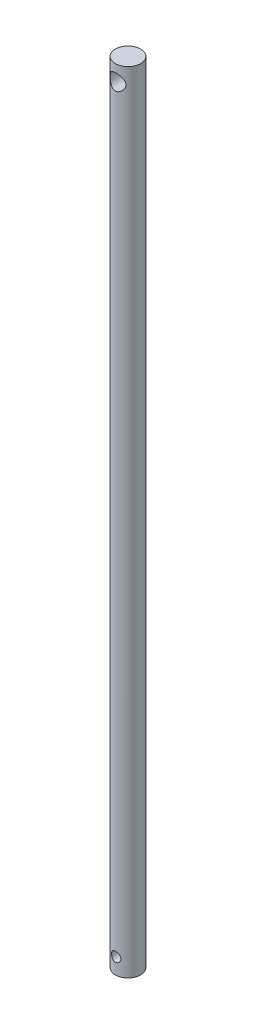
from build123d import *

# Parameters (mm, degrees)
SKETCH1_R               = 4
BOSS_EXTRUDE1_DEPTH     = 250
CUT_EXTRUDE1_DEPTH      = 251.06399181
CUT_EXTRUDE1_DEPTH_BACK = 251.06399181
SKETCH2_R               = 1.5
SKETCH2_R_2             = 2.5


with BuildPart() as part:
    # Sketch1 → Boss-Extrude1 (new body)
    with BuildSketch(Plane(origin=(0, 0, 0), x_dir=(1, 0, 0), z_dir=(0, 1, 0))):
        with Locations(Location((0, 0, 0), (0, 0, 270))):
            Circle(SKETCH1_R)
    extrude(amount=BOSS_EXTRUDE1_DEPTH)

    # Sketch2 → Cut-Extrude1 (cut, two sides: drawn at the far end of the back side and taken through both)
    with BuildSketch(Plane.XY.offset(-CUT_EXTRUDE1_DEPTH_BACK)):
        with Locations(Location((0, 5, 0), (0, 0, 90.000000025))):
            Circle(SKETCH2_R)
        with Locations((0, 245)):
            Circle(SKETCH2_R_2)
    extrude(amount=CUT_EXTRUDE1_DEPTH + CUT_EXTRUDE1_DEPTH_BACK, mode=Mode.SUBTRACT)


solid = part.part
